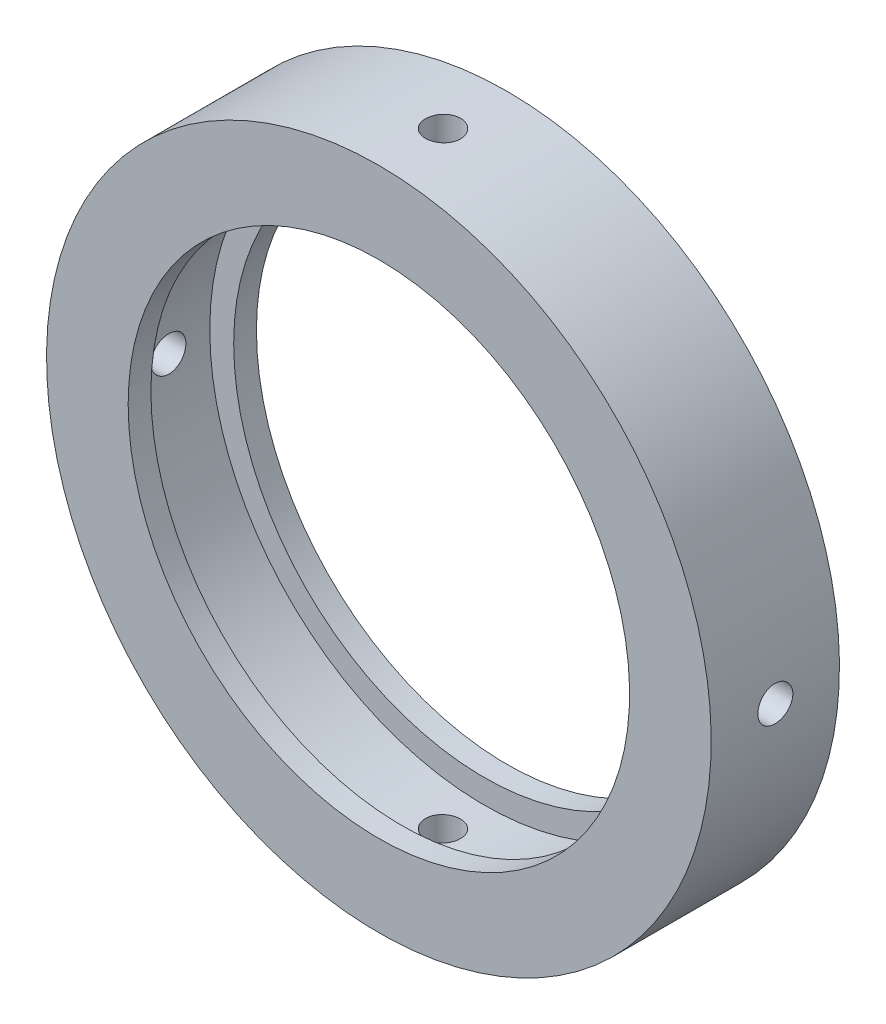
from build123d import *

# Parameters (mm, degrees)
SKETCH1_R           = 28.5
SKETCH1_R_2         = 21.5
EXTRUDE_THIN1_DEPTH = 11
CUT_EXTRUDE1_START  = -1.95
SKETCH2_R           = 23.55
CUT_EXTRUDE1_DEPTH  = 7.1
SKETCH3_R           = 1.5
CUT_EXTRUDE2_DEPTH  = 42.779181419
CIRPATTERN1_COUNT   = 2
CIRPATTERN1_ANGLE   = 90


with BuildPart() as part:
    # Sketch1 → Extrude-Thin1 (new body)
    with BuildSketch(Plane(origin=(0, 0, 0), x_dir=(0, 1, 0), z_dir=(0, 0, 1))):
        Circle(SKETCH1_R)
        Circle(SKETCH1_R_2, mode=Mode.SUBTRACT)
    extrude(amount=EXTRUDE_THIN1_DEPTH)

    # Sketch2 → Cut-Extrude1 (cut)
    with BuildSketch(Plane(origin=(0, 0, 0), x_dir=(1, 0, 0), z_dir=(0, 0, -1)).offset(CUT_EXTRUDE1_START)):
        with Locations(Location((0, 0, 0), (0, 0, 180))):
            Circle(SKETCH2_R)
    extrude(amount=-CUT_EXTRUDE1_DEPTH, mode=Mode.SUBTRACT)

    # Sketch3 → Cut-Extrude2 (cut, symmetric)
    with BuildSketch(Plane.YZ):
        with Locations(Location((0, 5.5, 0), (0, 0, 270))):
            Circle(SKETCH3_R)
    cut_extrude2 = extrude(amount=CUT_EXTRUDE2_DEPTH, both=True, mode=Mode.SUBTRACT)

    # CirPattern1: Cut-Extrude2 ×2 about axis
    cirpattern1_axis = Axis((0, 0, 9.05), (0, 0, -1))
    for i in range(1, CIRPATTERN1_COUNT):
        add(cut_extrude2.rotate(cirpattern1_axis, i * CIRPATTERN1_ANGLE / (CIRPATTERN1_COUNT - 1)), mode=Mode.SUBTRACT)


solid = part.part
